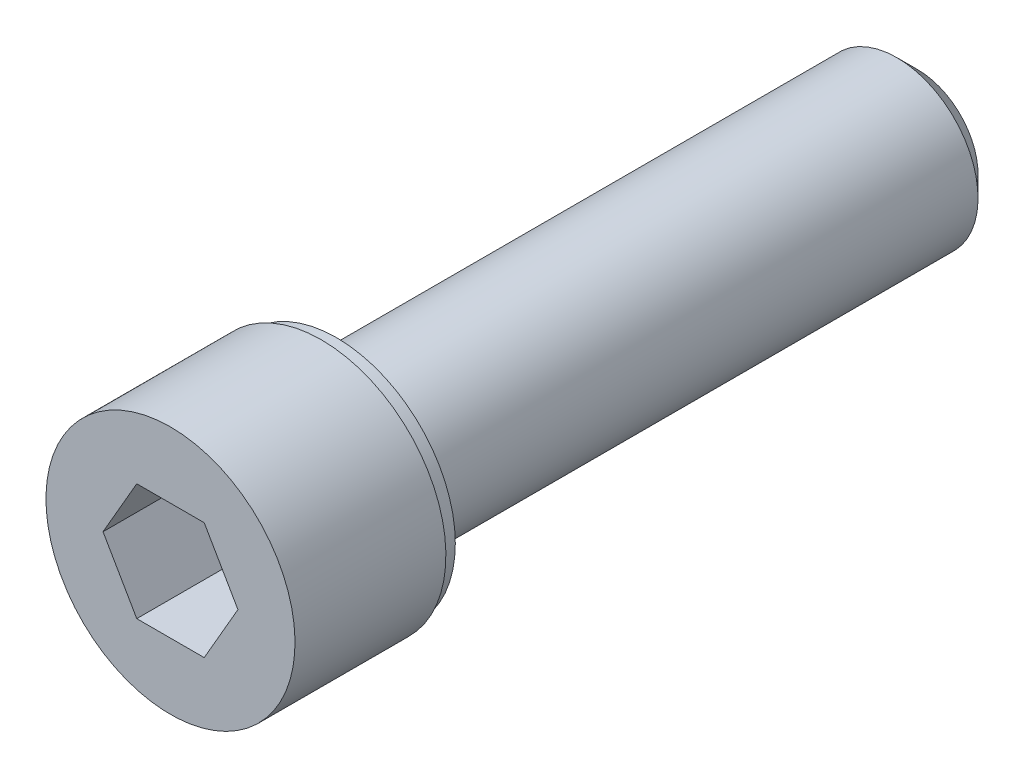
from build123d import *

# Parameters (mm, degrees)
REDONDEO1_R           = 0.2
CHAFL_N1_SIZE         = 0.5
CORTAR_EXTRUIR1_DEPTH = 2.75


with BuildPart() as part:
    # Croquis1 → Revolución1 (revolve)
    with BuildSketch(Plane(origin=(0, 0, 0), x_dir=(0, 0, -1), z_dir=(1, 0, 0))):
        Polygon((0, 3), (3.63504566, 3), (3.63504566, 2.862019845), (4, 2.862019845), (4, 1.955), (18, 1.955), (18, 0), (0, 0), align=None)
    revolve(axis=Axis((0, 0, -18), (0, 0, 1)))

    # Redondeo1
    redondeo1_edges = [part.edges().sort_by_distance(p)[0] for p in [
        (0, -1.955, -4),
    ]]
    fillet(redondeo1_edges, radius=REDONDEO1_R)

    # Chaflán1
    chafl_n1_edges = [part.edges().sort_by_distance(p)[0] for p in [
        (0, -1.955, -18),
    ]]
    chamfer(chafl_n1_edges, length=CHAFL_N1_SIZE)

    # Croquis2 → Cortar-Extruir1 (cut)
    with BuildSketch(Plane.XY):
        Polygon((-1.625, 0), (-0.8125, -1.407291281), (0.8125, -1.407291281), (1.625, 0), (0.8125, 1.407291281), (-0.8125, 1.407291281), align=None)
    extrude(amount=-CORTAR_EXTRUIR1_DEPTH, mode=Mode.SUBTRACT)


solid = part.part
